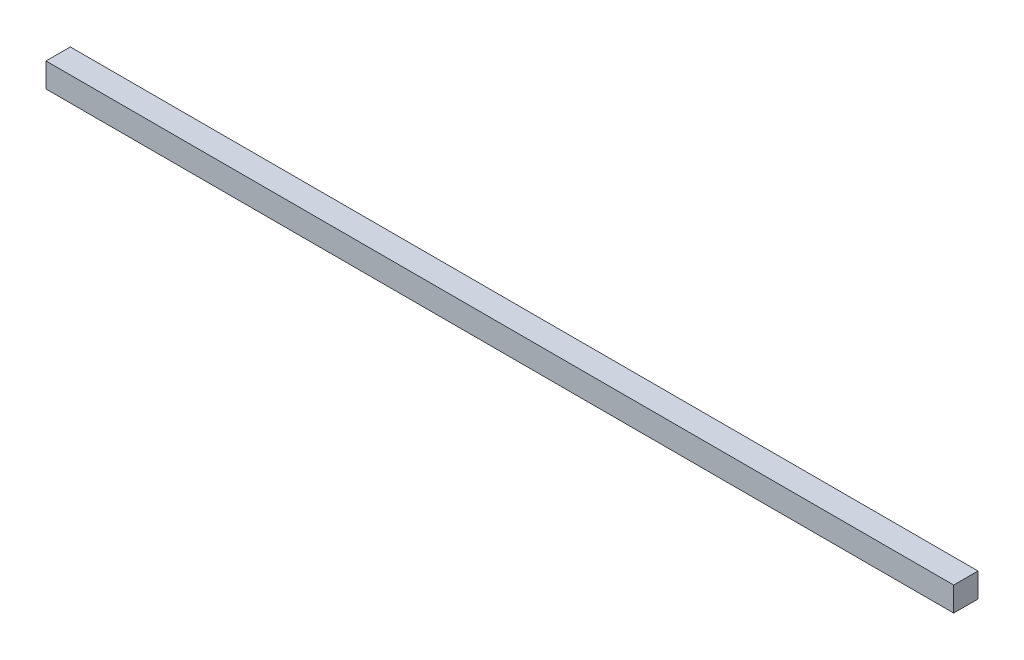
from build123d import *

# Parameters (mm, degrees)
SKETCH1_W           = 38.1
SKETCH1_H           = 38.1
BOSS_EXTRUDE1_DEPTH = 1422.4


with BuildPart() as part:
    # Sketch1 → Boss-Extrude1 (new body)
    with BuildSketch(Plane(origin=(0, 0, 0), x_dir=(0, 0, -1), z_dir=(1, 0, 0))):
        with Locations((19.05, -19.05)):
            Rectangle(SKETCH1_W, SKETCH1_H)
    extrude(amount=BOSS_EXTRUDE1_DEPTH)


solid = part.part
